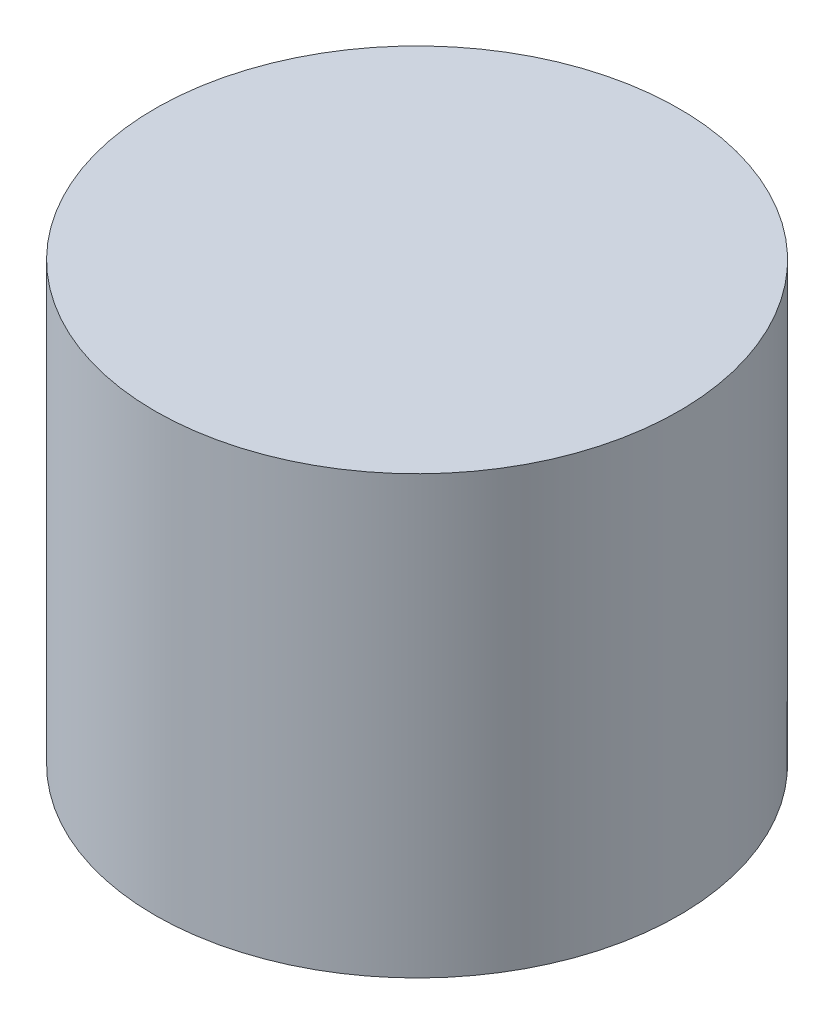
from build123d import *

# Parameters (mm, degrees)
SKETCH1_R           = 30
BOSS_EXTRUDE1_DEPTH = 50


with BuildPart() as part:
    # Sketch1 → Boss-Extrude1 (new body)
    with BuildSketch(Plane(origin=(0, 0, 0), x_dir=(1, 0, 0), z_dir=(0, 1, 0))):
        with Locations(Location((0, 0, 0), (0, 0, 270))):
            Circle(SKETCH1_R)
    extrude(amount=BOSS_EXTRUDE1_DEPTH)


solid = part.part
